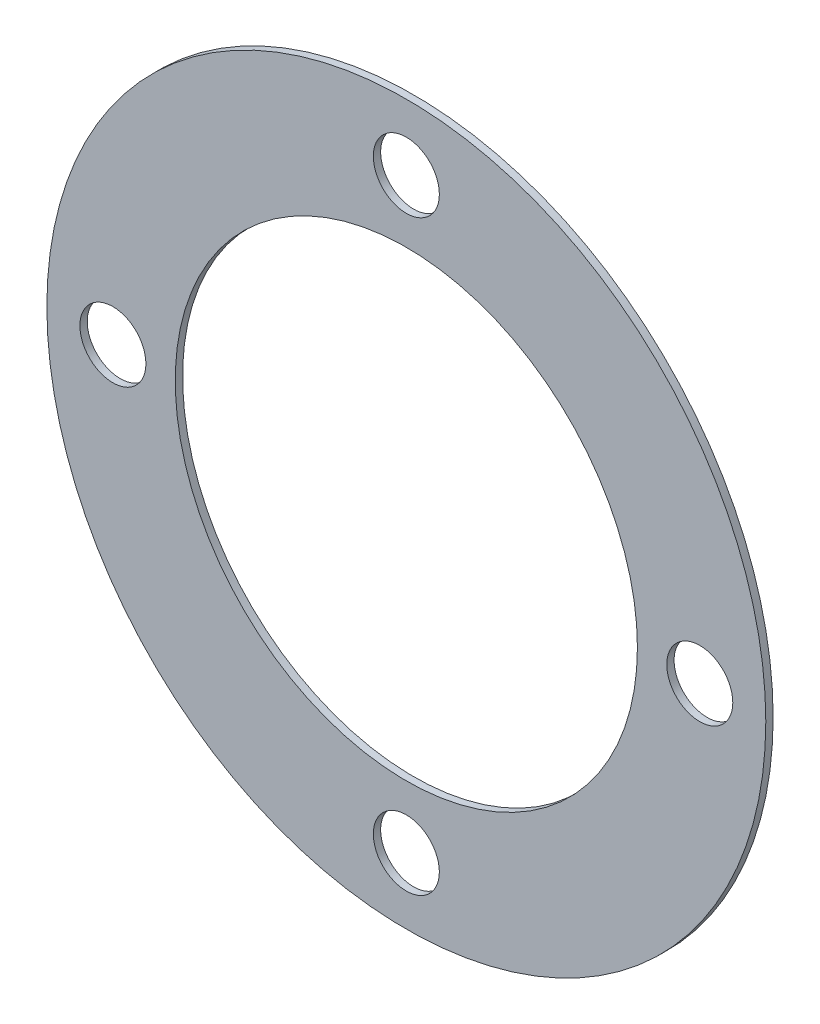
from build123d import *

# Parameters (mm, degrees)
SKETCH_1_R          = 49
SKETCH_1_R_2        = 31.5
EXTRUDE_1_DEPTH     = 1
SKETCH_2_R          = 4.5
CUT_EXTRUDE_1_DEPTH = 1


with BuildPart() as part:
    # 草图1 → 凸台-拉伸1 (new body)
    with BuildSketch(Plane.XY):
        Circle(SKETCH_1_R)
        Circle(SKETCH_1_R_2, mode=Mode.SUBTRACT)
    extrude(amount=EXTRUDE_1_DEPTH)

    # 草图2 → 切除-拉伸1 (cut)
    with BuildSketch(Plane.XY.offset(1)):
        with Locations((0, 40)):
            Circle(SKETCH_2_R)
        with Locations((40, 0)):
            Circle(SKETCH_2_R)
        with Locations((0, -40)):
            Circle(SKETCH_2_R)
        with Locations((-40, 0)):
            Circle(SKETCH_2_R)
    extrude(amount=-CUT_EXTRUDE_1_DEPTH, mode=Mode.SUBTRACT)


solid = part.part
